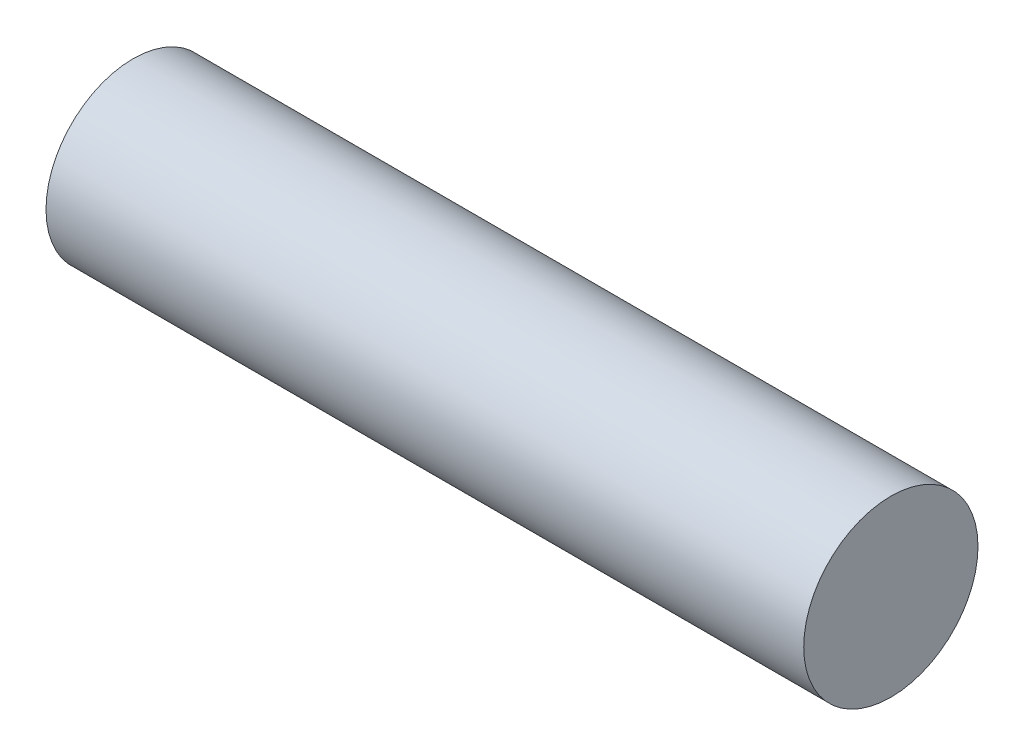
from build123d import *

# Parameters (mm, degrees)
SKETCH1_R           = 1.4605
BOSS_EXTRUDE1_DEPTH = 12.7


with BuildPart() as part:
    # Sketch1 → Boss-Extrude1 (new body)
    with BuildSketch(Plane(origin=(0, 0, 0), x_dir=(0, 0, -1), z_dir=(1, 0, 0))):
        Circle(SKETCH1_R)
    extrude(amount=BOSS_EXTRUDE1_DEPTH)


solid = part.part
